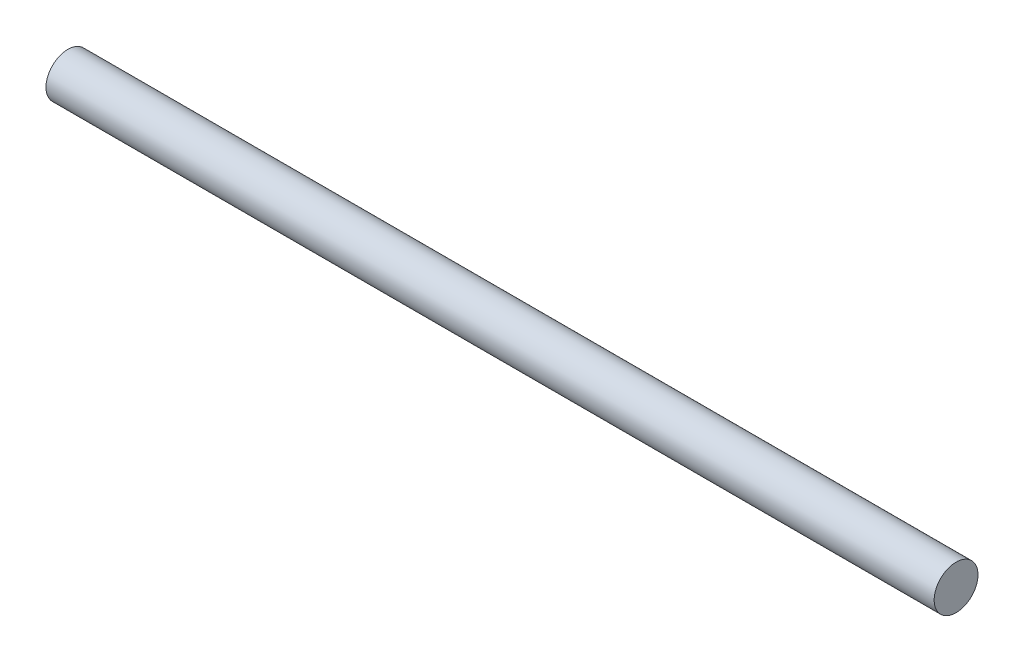
from build123d import *

# Parameters (mm, degrees)
SKETCH2_R           = 6
BOSS_EXTRUDE1_DEPTH = 121.540305705


with BuildPart() as part:
    # Sketch2 → Boss-Extrude1 (new, symmetric)
    with BuildSketch(Plane(origin=(0, 0, 0), x_dir=(0, 0, -1), z_dir=(1, 0, 0))):
        Circle(SKETCH2_R)
    extrude(amount=BOSS_EXTRUDE1_DEPTH, both=True)


solid = part.part
